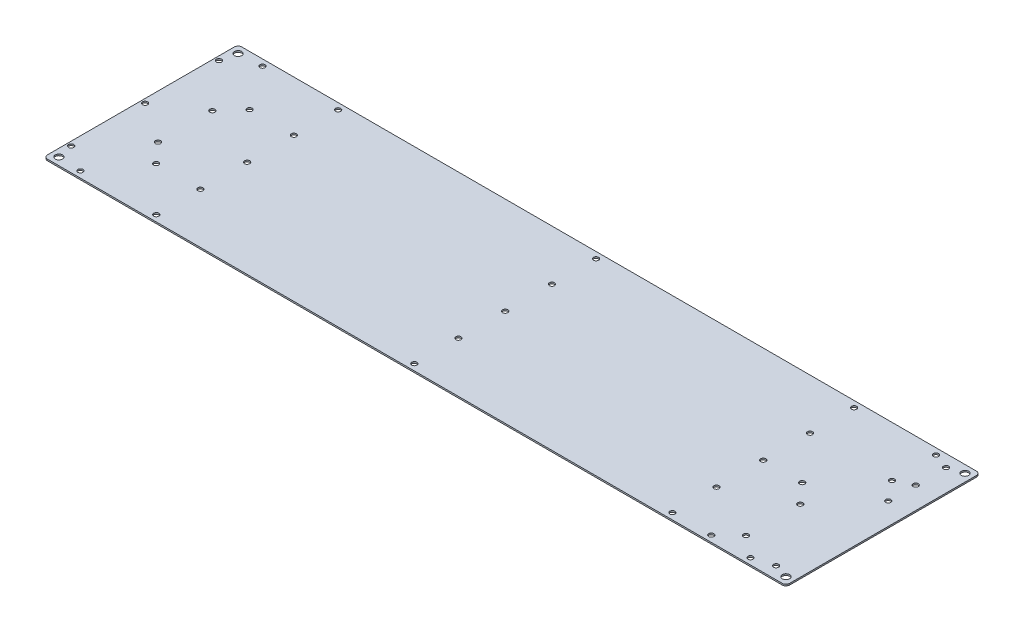
from build123d import *

# Parameters (mm, degrees)
SKETCH1_W            = 488.95
SKETCH1_H            = 128
BOSS_EXTRUDE1_DEPTH  = 1
FILLET1_R            = 2.5
M4_CLEARANCE_HOLE1_D = 4.8
M3_CLEARANCE_HOLE1_D = 3.4


with BuildPart() as part:
    # Sketch1 → Boss-Extrude1 (new body)
    with BuildSketch(Plane(origin=(0, 0, 0), x_dir=(1, 0, 0), z_dir=(0, 1, 0))):
        Rectangle(SKETCH1_W, SKETCH1_H)
    extrude(amount=BOSS_EXTRUDE1_DEPTH)

    # Fillet1
    fillet1_edges = [part.edges().sort_by_distance(p)[0] for p in [
        (244.475, 0.5, 64),
        (-244.475, 0.5, 64),
        (-244.475, 0.5, -64),
        (244.475, 0.5, -64),
    ]]
    fillet(fillet1_edges, radius=FILLET1_R)

    # M4 Clearance Hole1 (through all)
    with Locations(Plane(origin=(0, 1, 0), x_dir=(1, 0, 0), z_dir=(0, 1, 0))):
        with Locations((239.475, -59), (239.475, 59), (-239.475, -59), (-239.475, 59)):
            Hole(M4_CLEARANCE_HOLE1_D / 2)

    # M3 Clearance Hole1 (through all)
    with Locations(Plane(origin=(0, 1, 0), x_dir=(1, 0, 0), z_dir=(0, 1, 0))):
        with Locations((229.975, -56), (216.975, -59.85), (202.825, -48.7), (191.175, -59.85), (165.525, -59.85), (-4.475, -59.85), (-241.725, -48.7), (-224.475, -59.85), (-174.475, -59.85), (-241.725, 0), (-241.725, 48.7), (-203.675, -30.8), (-174.475, -30.8), (-215.325, -17.9), (-4.475, -30.8), (165.525, -30.8), (229.975, 56), (219.475, 59.85), (229.975, 36), (219.475, 30.8), (229.975, 17.9), (202.825, -12.9), (191.175, 0), (165.525, 0), (165.525, 30.8), (165.525, 59.85), (-4.475, 59.85), (-174.397977499, 59.85), (-224.23299272, 59.85), (-174.475, 30.8), (-174.475, 0), (-215.325, 17.9), (-203.675, 30.8), (-4.475, 30.8), (-4.475, 0)):
            Hole(M3_CLEARANCE_HOLE1_D / 2)


solid = part.part
